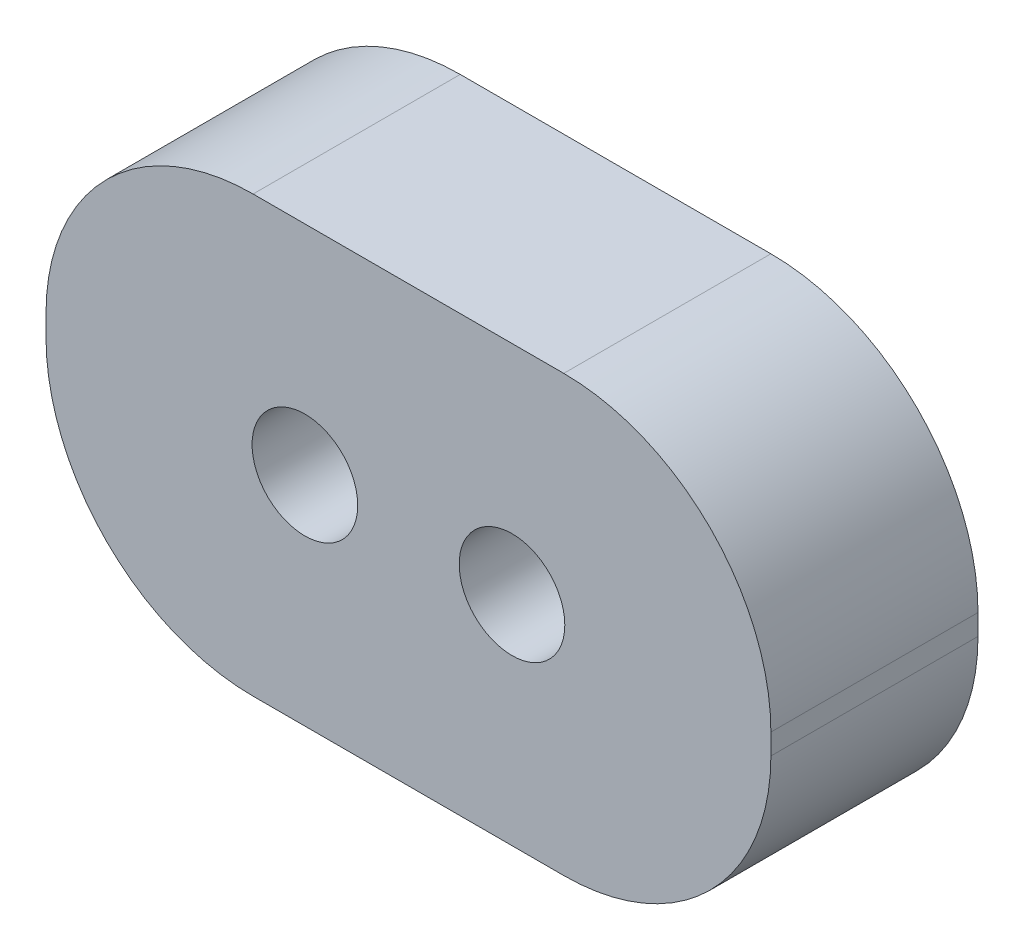
from build123d import *

# Parameters (mm, degrees)
SZKIC1_R                    = 2.55
DODANIE_WYCI_GNI_CIE1_DEPTH = 10


with BuildPart() as part:
    # Szkic1 → Dodanie-wyciągnięcie1 (new body)
    with BuildSketch(Plane.XY):
        with BuildLine():
            Line((-158.52281754, 286.237393464), (-173.52281754, 286.237393464))
            ThreePointArc((-173.52281754, 286.237393464), (-180.593885352, 289.166325652), (-183.52281754, 296.237393464))
            Line((-183.52281754, 296.237393464), (-183.52281754, 297.237393461))
            ThreePointArc((-183.52281754, 297.237393461), (-180.593885352, 304.308461273), (-173.52281754, 307.237393461))
            Line((-173.52281754, 307.237393461), (-158.52281754, 307.237393461))
            ThreePointArc((-158.52281754, 307.237393461), (-151.451749728, 304.308461273), (-148.52281754, 297.237393461))
            Line((-148.52281754, 297.237393461), (-148.52281754, 296.237393464))
            ThreePointArc((-148.52281754, 296.237393464), (-151.451749728, 289.166325652), (-158.52281754, 286.237393464))
        make_face()
        with Locations((-171.02281754, 296.737393463)):
            Circle(SZKIC1_R, mode=Mode.SUBTRACT)
        with Locations((-161.02281754, 296.737393463)):
            Circle(SZKIC1_R, mode=Mode.SUBTRACT)
    extrude(amount=DODANIE_WYCI_GNI_CIE1_DEPTH)


solid = part.part
